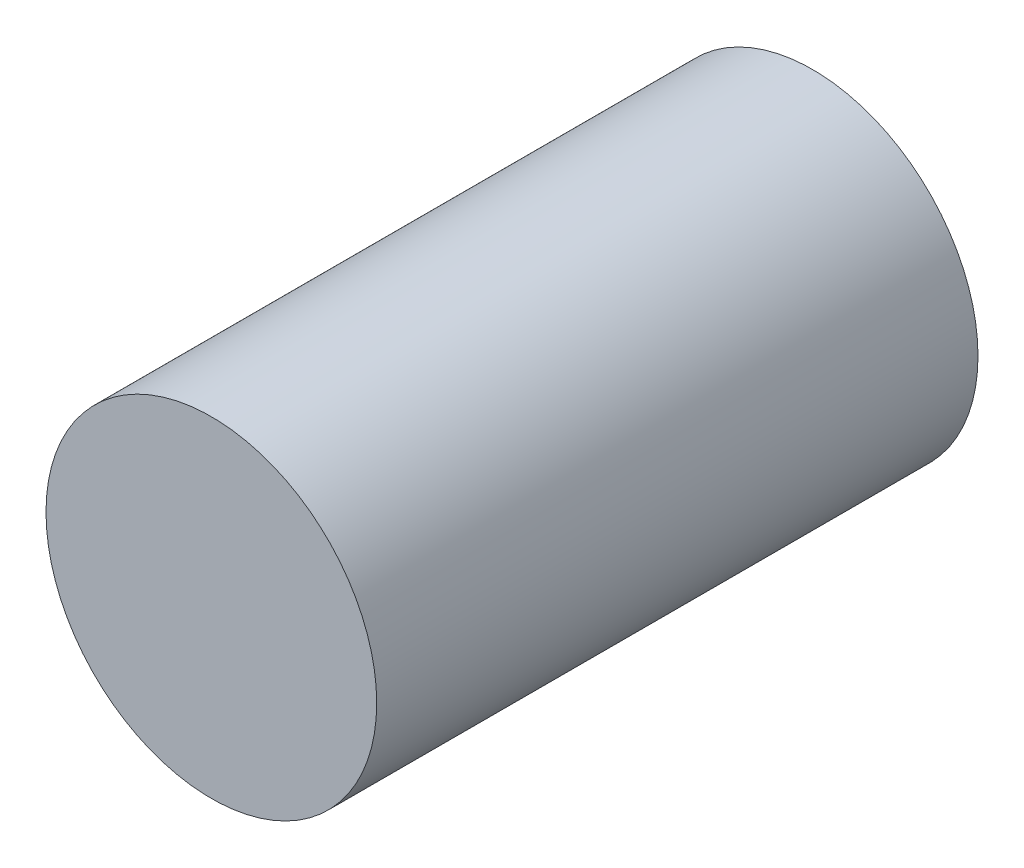
from build123d import *

# Parameters (mm, degrees)
SKETCH1_R           = 1.65
BOSS_EXTRUDE1_DEPTH = 6


with BuildPart() as part:
    # Sketch1 → Boss-Extrude1 (new body)
    with BuildSketch(Plane.XY):
        Circle(SKETCH1_R)
    extrude(amount=BOSS_EXTRUDE1_DEPTH)


solid = part.part
